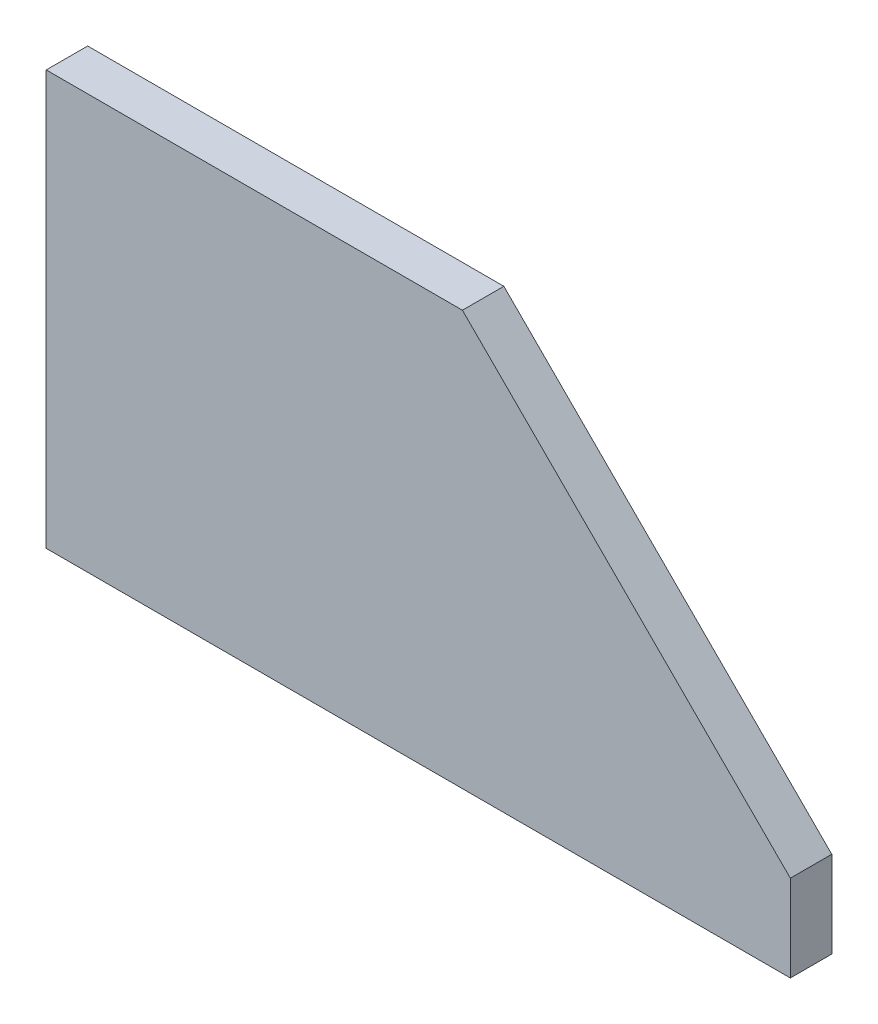
from build123d import *

# Parameters (mm, degrees)
EXTRUDE1_DEPTH = 12


with BuildPart() as part:
    # Sketch1 → Extrude1 (new body)
    with BuildSketch(Plane.XY):
        Polygon((120.53, 120), (215.5, 25.03), (215.5, 0), (0, 0), (0, 120), align=None)
    extrude(amount=EXTRUDE1_DEPTH)


solid = part.part
